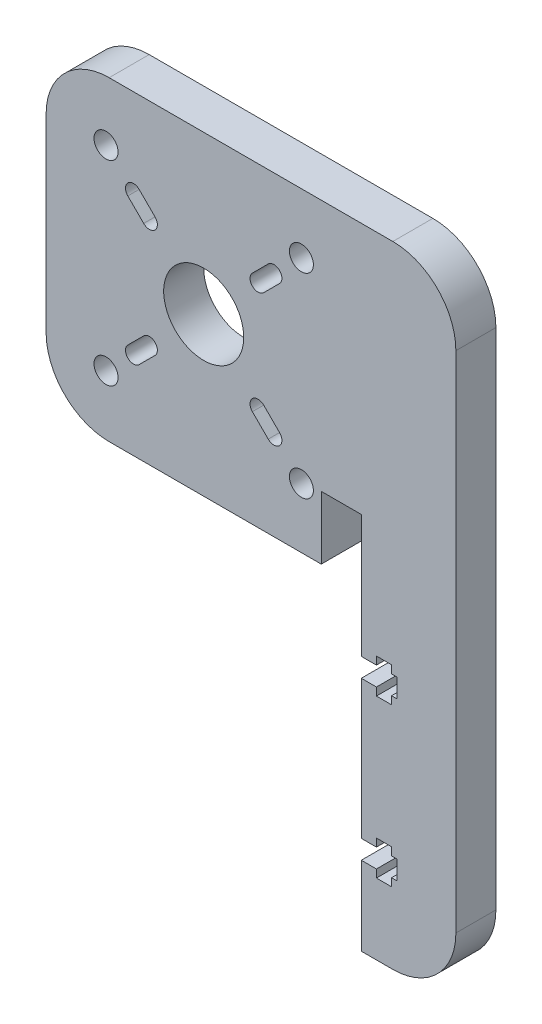
from build123d import *

# Parameters (mm, degrees)
SKETCH1_R           = 1.905
SKETCH1_R_2         = 6.35
BOSS_EXTRUDE1_DEPTH = 6.35
FILLET1_R           = 10


with BuildPart() as part:
    # Sketch1 → Boss-Extrude1 (new body)
    with BuildSketch(Plane.XY):
        Polygon((18.65, -15), (25, -15), (25, -34.5), (27.4, -34.5), (27.4, -33.25), (29.8, -33.25), (29.8, -34.5), (30.65, -34.5), (30.65, -37.5), (29.8, -37.5), (29.8, -38.75), (27.4, -38.75), (27.4, -37.5), (25, -37.5), (25, -59.5), (27.4, -59.5), (27.4, -58.25), (29.8, -58.25), (29.8, -59.5), (30.65, -59.5), (30.65, -62.5), (29.8, -62.5), (29.8, -63.75), (27.4, -63.75), (27.4, -62.5), (25, -62.5), (25, -75), (40, -75), (40, 25), (-25, 25), (-25, -25), (18.65, -25), align=None)
        with Locations((-15.494, -15.494)):
            Circle(SKETCH1_R, mode=Mode.SUBTRACT)
        with BuildLine():
            ThreePointArc((-10.237491978, -12.033543202), (-12.033543202, -12.033543202), (-12.033543202, -10.237491978))
            Line((-12.033543202, -10.237491978), (-9.519071488, -7.723020264))
            ThreePointArc((-9.519071488, -7.723020264), (-7.723020264, -7.723020264), (-7.723020264, -9.519071488))
            Line((-7.723020264, -9.519071488), (-10.237491978, -12.033543202))
        make_face(mode=Mode.SUBTRACT)
        Circle(SKETCH1_R_2, mode=Mode.SUBTRACT)
        with BuildLine():
            ThreePointArc((-12.033543202, 10.237491978), (-12.033543202, 12.033543202), (-10.237491978, 12.033543202))
            Line((-10.237491978, 12.033543202), (-7.723020264, 9.519071488))
            ThreePointArc((-7.723020264, 9.519071488), (-7.723020264, 7.723020264), (-9.519071488, 7.723020264))
            Line((-9.519071488, 7.723020264), (-12.033543202, 10.237491978))
        make_face(mode=Mode.SUBTRACT)
        with Locations((-15.494, 15.494)):
            Circle(SKETCH1_R, mode=Mode.SUBTRACT)
        with Locations((15.494, -15.494)):
            Circle(SKETCH1_R, mode=Mode.SUBTRACT)
        with BuildLine():
            ThreePointArc((12.033543202, -10.237491978), (12.033543202, -12.033543202), (10.237491978, -12.033543202))
            Line((10.237491978, -12.033543202), (7.723020264, -9.519071488))
            ThreePointArc((7.723020264, -9.519071488), (7.723020264, -7.723020264), (9.519071488, -7.723020264))
            Line((9.519071488, -7.723020264), (12.033543202, -10.237491978))
        make_face(mode=Mode.SUBTRACT)
        with BuildLine():
            ThreePointArc((10.237491978, 12.033543202), (12.033543202, 12.033543202), (12.033543202, 10.237491978))
            Line((12.033543202, 10.237491978), (9.519071488, 7.723020264))
            ThreePointArc((9.519071488, 7.723020264), (7.723020264, 7.723020264), (7.723020264, 9.519071488))
            Line((7.723020264, 9.519071488), (10.237491978, 12.033543202))
        make_face(mode=Mode.SUBTRACT)
        with Locations((15.494, 15.494)):
            Circle(SKETCH1_R, mode=Mode.SUBTRACT)
    extrude(amount=BOSS_EXTRUDE1_DEPTH)

    # Fillet1
    fillet1_edges = [part.edges().sort_by_distance(p)[0] for p in [
        (-25, -25, 3.175),
        (-25, 25, 3.175),
        (40, 25, 3.175),
        (40, -75, 3.175),
    ]]
    fillet(fillet1_edges, radius=FILLET1_R)


solid = part.part
